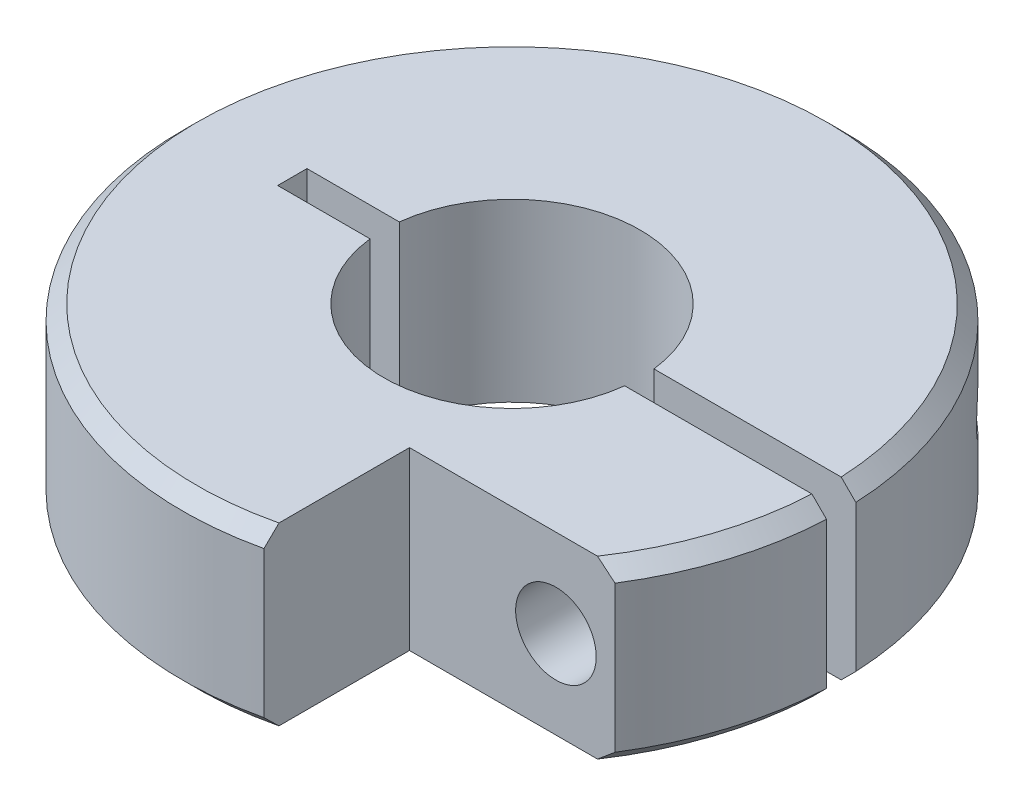
from build123d import *

# Parameters (mm, degrees)
SKETCH_1_R                  = 22.5
EXTRUDE_1_DEPTH             = 6
HOLE_WIZARD_M20_1_D         = 17.5
SKETCH_2_W                  = 37.5
SKETCH_2_H                  = 2
CUT_EXTRUDE_1_DEPTH         = 35.007352146
CUT_EXTRUDE_2_DEPTH         = 35.007352146
HOLE_WIZARD_5_5_5_5_1_D     = 5.5
HOLE_WIZARD_5_5_5_5_1_DEPTH = 11
HOLE_WIZARD_M5_2_D          = 4.2
CHAMFER_1_SIZE              = 1


with BuildPart() as part:
    # 草图1 → 凸台-拉伸1 (new, symmetric)
    with BuildSketch(Plane(origin=(0, 0, 0), x_dir=(1, 0, 0), z_dir=(0, 1, 0))):
        with Locations(Location((0, 0, 0), (0, 0, 270))):
            Circle(SKETCH_1_R)
    extrude(amount=EXTRUDE_1_DEPTH, both=True)

    # M20 螺纹孔1 (through all)
    with Locations(Plane(origin=(0, 6, 0), x_dir=(1, 0, 0), z_dir=(0, 1, 0))):
        with Locations((0, 0)):
            Hole(HOLE_WIZARD_M20_1_D / 2)

    # 草图2 → 切除-拉伸1 (cut, through all)
    with BuildSketch(Plane(origin=(0, 6, 0), x_dir=(1, 0, 0), z_dir=(0, 1, 0))):
        with Locations((3.75, 0)):
            Rectangle(SKETCH_2_W, SKETCH_2_H)
    extrude(amount=-CUT_EXTRUDE_1_DEPTH, mode=Mode.SUBTRACT)

    # 草图6 → 切除-拉伸2 (cut, through all)
    with BuildSketch(Plane(origin=(0, 6, 0), x_dir=(1, 0, 0), z_dir=(0, 1, 0))):
        with BuildLine():
            Line((19.032866311, -12), (5, -12))
            Line((5, -12), (5, -21.937410968))
            ThreePointArc((5, -21.937410968), (13.003180379, -18.362115892), (19.032866311, -12))
        make_face()
    extrude(amount=-CUT_EXTRUDE_2_DEPTH, mode=Mode.SUBTRACT)

    # Ø5.5 (5.5) 直径孔1
    with Locations(Plane.XY.offset(12)):
        with Locations((15, 0)):
            Hole(HOLE_WIZARD_5_5_5_5_1_D / 2, depth=HOLE_WIZARD_5_5_5_5_1_DEPTH)

    # M5 螺纹孔2 (through all)
    with Locations(Plane(origin=(-28, -6, -1), x_dir=(1, 0, 0), z_dir=(0, 0, 1))):
        with Locations((43, 6)):
            Hole(HOLE_WIZARD_M5_2_D / 2)

    # 倒角1
    chamfer_1_edges = [part.edges().sort_by_distance(p)[0] for p in [
        (-17.896595276, -6, -13.636783988),
        (-17.896595276, 6, -13.636783988),
        (21.471682868, -6, 6.724346424),
        (21.471682868, 6, 6.724346424),
    ]]
    chamfer(chamfer_1_edges, length=CHAMFER_1_SIZE)


solid = part.part
